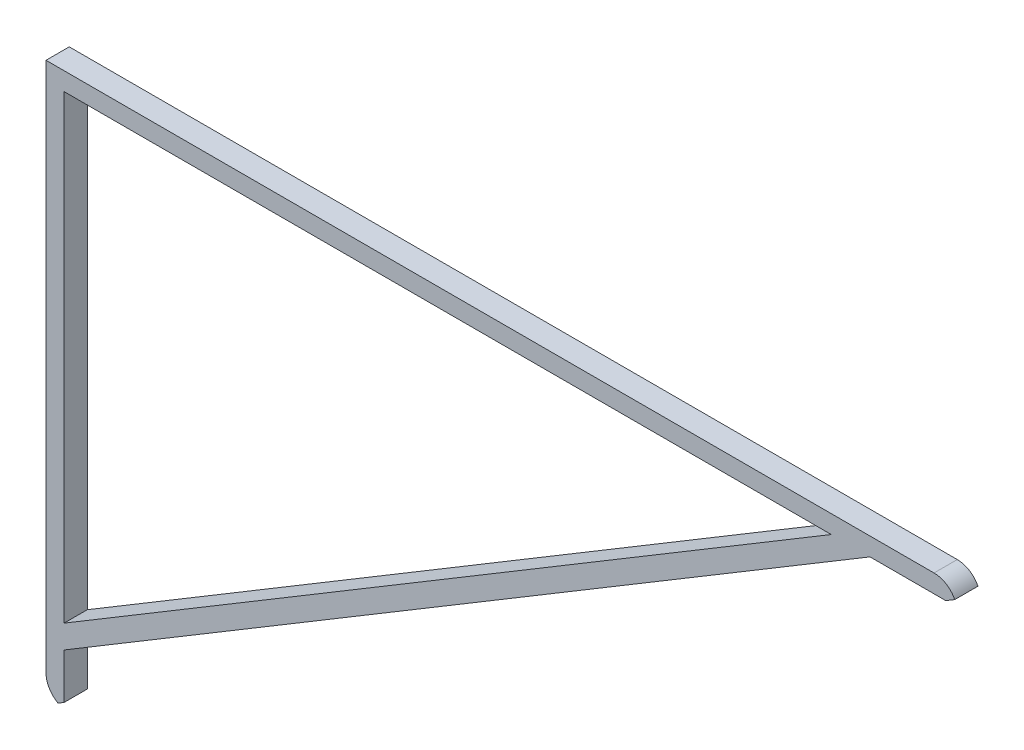
from build123d import *

# Parameters (mm, degrees)
BOSS_EXTRU_4_DEPTH = 5


with BuildPart() as part:
    # Esquisse1 → Boss.-Extru.4 (new body)
    with BuildSketch(Plane.XY):
        with BuildLine():
            Line((0, 0), (190.985155098, 0))
            ThreePointArc((190.985155098, 0), (193.599787646, -0.738111142), (195.442464428, -2.734521343))
            Line((195.442464428, -2.734521343), (193.518187839, -3.889087297))
            Line((193.518187839, -3.889087297), (177.22242063, -3.889087297))
            Line((177.22242063, -3.889087297), (3.889087297, -107.889087297))
            Line((3.889087297, -107.889087297), (3.889087297, -117.666547622))
            Line((3.889087297, -117.666547622), (2.58933145, -118.44640113))
            ThreePointArc((2.58933145, -118.44640113), (0.695737999, -116.610186592), (0, -114.065912899))
            Line((0, -114.065912899), (0, 0))
        make_face()
        Polygon((3.889087297, -102.889087297), (168.889087297, -3.889087297), (3.889087297, -3.889087297), align=None, mode=Mode.SUBTRACT)
    extrude(amount=BOSS_EXTRU_4_DEPTH)


solid = part.part
